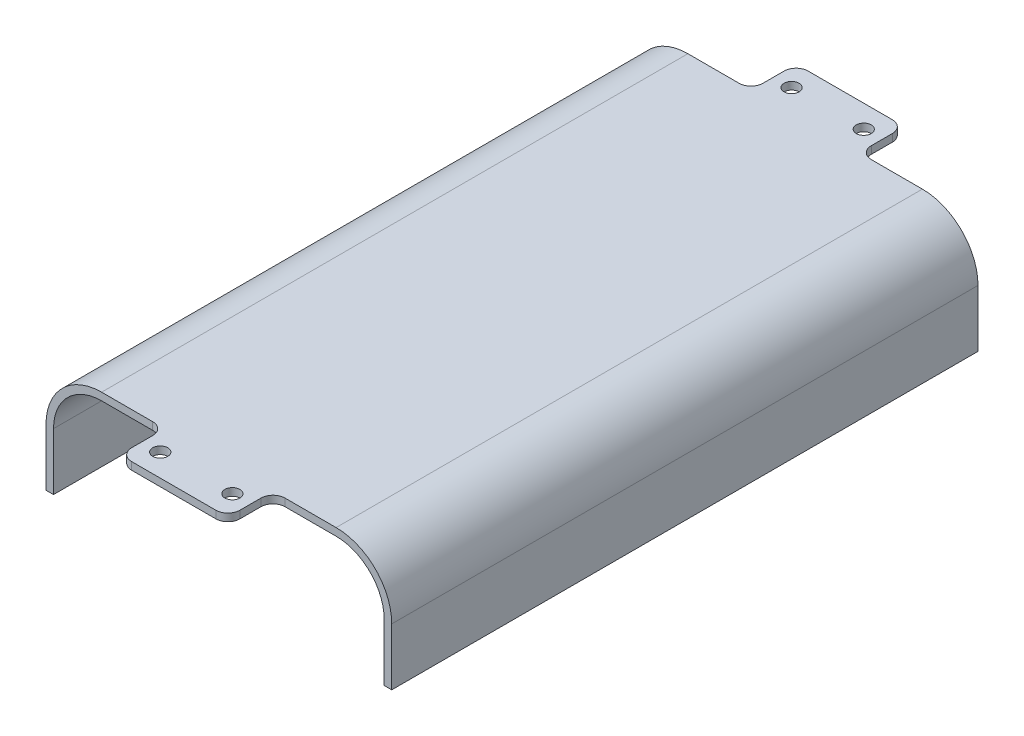
from build123d import *

# Parameters (mm, degrees)
EXTRUDE_1_DEPTH     = 225
SHELL_2_T           = 2.5
SKETCH_2_R          = 2.5
CUT_EXTRUDE_1_DEPTH = 236.239239924


with BuildPart() as part:
    # 草图1 → 凸台-拉伸1 (new body)
    with BuildSketch(Plane.XY):
        with BuildLine():
            Line((-39, 17.5), (39, 17.5))
            ThreePointArc((39, 17.5), (50.313708499, 12.813708499), (55, 1.5))
            Line((55, 1.5), (55, -17.5))
            Line((55, -17.5), (-55, -17.5))
            Line((-55, -17.5), (-55, 1.5))
            ThreePointArc((-55, 1.5), (-50.313708499, 12.813708499), (-39, 17.5))
        make_face()
    extrude(amount=EXTRUDE_1_DEPTH)

    # 抽壳2
    shell_2_openings = [part.faces().sort_by_distance(p)[0] for p in [
        (0, -17.5, 112.5),
        (0, -0.40911681, 0),
        (0, -0.40911681, 225),
    ]]
    offset(amount=SHELL_2_T, openings=shell_2_openings, kind=Kind.INTERSECTION)

    # 草图2 → 切除-拉伸1 (cut, through all)
    with BuildSketch(Plane(origin=(0, 20, 0), x_dir=(1, 0, 0), z_dir=(0, 1, 0))):
        with Locations(Location((-12, -7.5, 0), (0, 0, 270))):
            Circle(SKETCH_2_R)
        with Locations(Location((12, -7.5, 0), (0, 0, 270))):
            Circle(SKETCH_2_R)
        with Locations(Location((-12, -217.5, 0), (0, 0, 90))):
            Circle(SKETCH_2_R)
        with Locations(Location((12, -217.5, 0), (0, 0, 90))):
            Circle(SKETCH_2_R)
        with BuildLine():
            Line((-14, 0), (-74.033168475, 0))
            Line((-74.033168475, 0), (-74.033168475, -15))
            Line((-74.033168475, -15), (-57.5, -15))
            Line((-57.5, -15), (-22, -15))
            ThreePointArc((-22, -15), (-19.171572875, -13.828427125), (-18, -11))
            Line((-18, -11), (-18, -4))
            ThreePointArc((-18, -4), (-16.828427125, -1.171572875), (-14, 0))
        make_face()
        with BuildLine():
            Line((57.5, -15), (57.5, 0))
            Line((57.5, 0), (14, 0))
            ThreePointArc((14, 0), (16.828427125, -1.171572875), (18, -4))
            Line((18, -4), (18, -11))
            ThreePointArc((18, -11), (19.171572875, -13.828427125), (22, -15))
            Line((22, -15), (57.5, -15))
        make_face()
        with BuildLine():
            Line((18, -221), (18, -214))
            ThreePointArc((18, -214), (19.171572875, -211.171572875), (22, -210))
            Line((22, -210), (57.5, -210))
            Line((57.5, -210), (57.5, -225))
            Line((57.5, -225), (14, -225))
            ThreePointArc((14, -225), (16.828427125, -223.828427125), (18, -221))
        make_face()
        with BuildLine():
            Line((-18, -221), (-18, -214))
            ThreePointArc((-18, -214), (-19.171572875, -211.171572875), (-22, -210))
            Line((-22, -210), (-57.5, -210))
            Line((-57.5, -210), (-74.033168475, -210))
            Line((-74.033168475, -210), (-74.033168475, -225))
            Line((-74.033168475, -225), (-14, -225))
            ThreePointArc((-14, -225), (-16.828427125, -223.828427125), (-18, -221))
        make_face()
    extrude(amount=-CUT_EXTRUDE_1_DEPTH, mode=Mode.SUBTRACT)


solid = part.part
